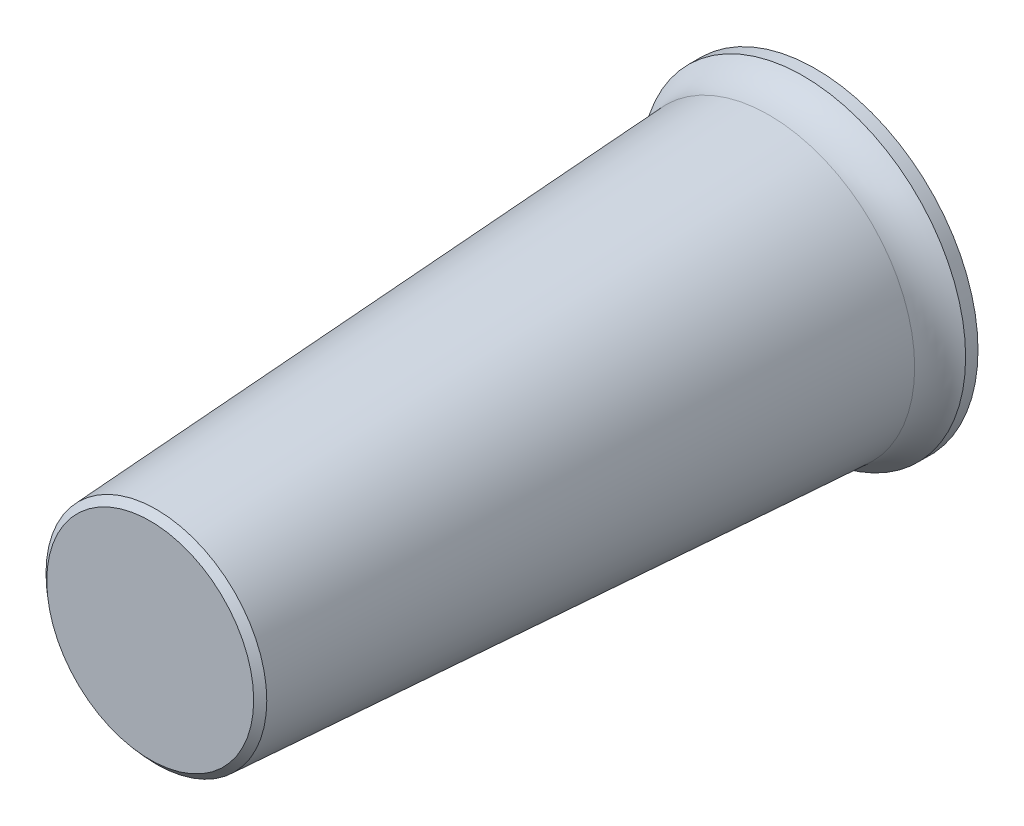
from build123d import *

# Parameters (mm, degrees)
CHAMFER1_SIZE  = 0.1
CHAMFER1_SIZE2 = 0.106295026


with BuildPart() as part:
    # Sketch1 → Revolve1 (revolve)
    with BuildSketch(Plane(origin=(0, 0, 0), x_dir=(0, 0, -1), z_dir=(1, 0, 0))):
        with BuildLine():
            Line((-10.75395, 0), (-0.75395, 0))
            Line((-0.75395, 0), (0, 0))
            Line((0, 0), (0, 2.624524576))
            Line((0, 2.624524576), (-0.2, 2.624524576))
            ThreePointArc((-0.2, 2.624524576), (-0.449991487, 2.434303461), (-0.75395, 2.355))
            Line((-0.75395, 2.355), (-10.75395, 1.778403628))
            Line((-10.75395, 1.778403628), (-10.75395, 0))
        make_face()
    revolve(axis=Axis((0, 0, 14.033730871), (0, 0, -1)))

    # Chamfer1
    chamfer1_edges = [part.edges().sort_by_distance(p)[0] for p in [
        (0, -1.778403628, 10.75395),
    ]]
    chamfer1_side = [part.faces().sort_by_distance(p)[0] for p in [
        (0, -2.066701814, 5.75395),
    ]]
    chamfer(chamfer1_edges, length=CHAMFER1_SIZE, length2=CHAMFER1_SIZE2, reference=chamfer1_side[0])


solid = part.part
